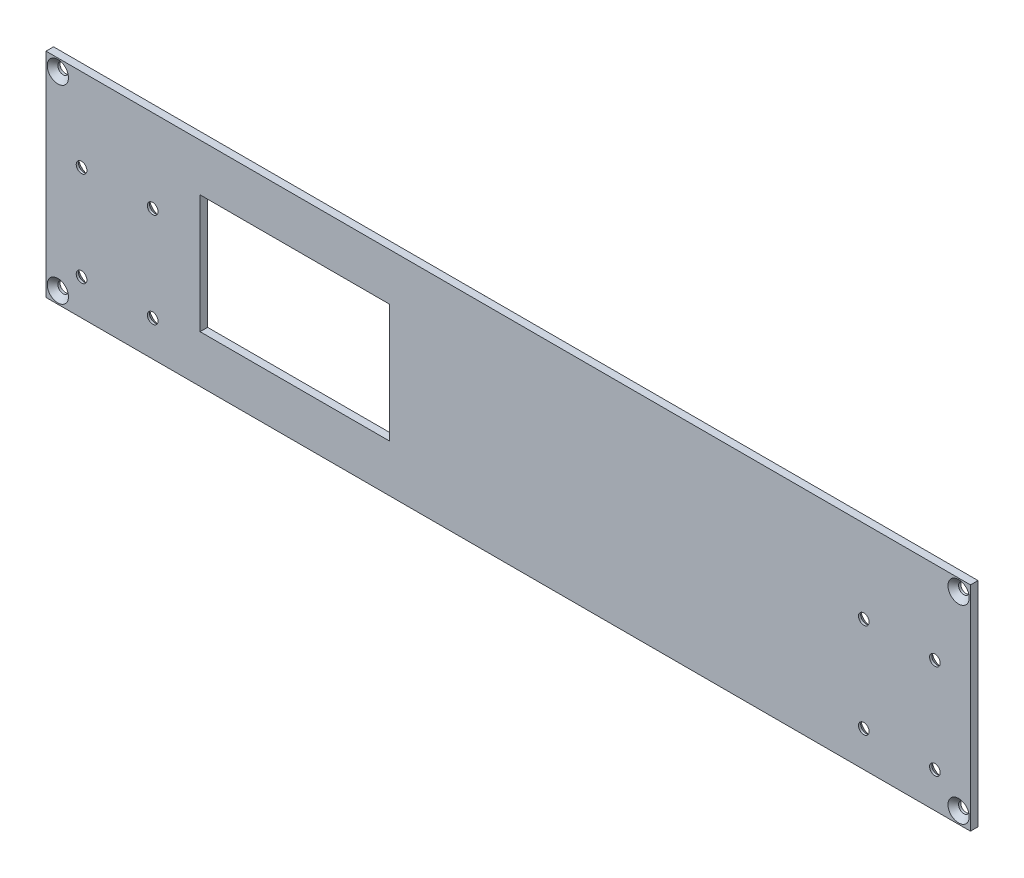
from build123d import *

# Parameters (mm, degrees)
SKETCH1_W                    = 390
SKETCH1_H                    = 90
BOSS_EXTRUDE1_DEPTH          = 3.175
CSK_FOR_M4_SFHCS1_AT_2_COUNT = 2
CSK_FOR_M4_SFHCS1_AT_2_PITCH = 50
CSK_FOR_M4_SFHCS1_AT_3_COUNT = 2
CSK_FOR_M4_SFHCS1_AT_3_PITCH = 30
CSK_FOR_M4_SFHCS1_AT_4_COUNT = 2
CSK_FOR_M4_SFHCS1_AT_4_PITCH = 40
CSK_FOR_M4_SFHCS3_AT_2_COUNT = 2
CSK_FOR_M4_SFHCS3_AT_2_PITCH = 80
SKETCH8_W                    = 80
SKETCH8_H                    = 50
CUT_EXTRUDE1_DEPTH           = 3.175


with BuildPart() as part:
    # Sketch1 → Boss-Extrude1 (new body)
    with BuildSketch(Plane.XY):
        Rectangle(SKETCH1_W, SKETCH1_H)
    extrude(amount=BOSS_EXTRUDE1_DEPTH)

    # Sketch5 → CSK for M4 SFHCS1 (revolve, cut)
    with BuildSketch(Plane(origin=(150, 10, 0), x_dir=(0, 1, 0), z_dir=(1, 0, 0))):
        Polygon((0, 0), (0, 3.175), (2.25, 3.175), (2.25, 2.23), (4.48, 0), align=None)
    csk_for_m4_sfhcs1 = revolve(axis=Axis((150, 10, -6.35), (0, 0, 1)), mode=Mode.SUBTRACT)

    # CSK for M4 SFHCS1 at 2: CSK for M4 SFHCS1 ×2
    with Locations(*[Vector(0.6, -0.8, 0) * (i * CSK_FOR_M4_SFHCS1_AT_2_PITCH) for i in range(1, CSK_FOR_M4_SFHCS1_AT_2_COUNT)]):
        add(csk_for_m4_sfhcs1, mode=Mode.SUBTRACT)

    # CSK for M4 SFHCS1 at 3: CSK for M4 SFHCS1 ×2
    with Locations(*[(i * CSK_FOR_M4_SFHCS1_AT_3_PITCH, 0, 0) for i in range(1, CSK_FOR_M4_SFHCS1_AT_3_COUNT)]):
        add(csk_for_m4_sfhcs1, mode=Mode.SUBTRACT)

    # CSK for M4 SFHCS1 at 4: CSK for M4 SFHCS1 ×2
    with Locations(*[(0, -i * CSK_FOR_M4_SFHCS1_AT_4_PITCH, 0) for i in range(1, CSK_FOR_M4_SFHCS1_AT_4_COUNT)]):
        add(csk_for_m4_sfhcs1, mode=Mode.SUBTRACT)

    # Sketch7 → CSK for M4 SFHCS3 (revolve, cut)
    with BuildSketch(Plane(origin=(190, 40, 3.175), x_dir=(0, -1, 0), z_dir=(1, 0, 0))):
        Polygon((0, 0), (0, 3.175), (2.25, 3.175), (2.25, 2.23), (4.48, 0), align=None)
    csk_for_m4_sfhcs3 = revolve(axis=Axis((190, 40, 9.525), (0, 0, -1)), mode=Mode.SUBTRACT)

    # CSK for M4 SFHCS3 at 2: CSK for M4 SFHCS3 ×2
    with Locations(*[(0, -i * CSK_FOR_M4_SFHCS3_AT_2_PITCH, 0) for i in range(1, CSK_FOR_M4_SFHCS3_AT_2_COUNT)]):
        add(csk_for_m4_sfhcs3, mode=Mode.SUBTRACT)

    # Mirror1: CSK for M4 SFHCS1, CSK for M4 SFHCS3 across plane
    add(csk_for_m4_sfhcs1.mirror(Plane(origin=(0, 0, 0), x_dir=(0, 0, 1), z_dir=(1, 0, 0))), mode=Mode.SUBTRACT)
    add(csk_for_m4_sfhcs3.mirror(Plane(origin=(0, 0, 0), x_dir=(0, 0, 1), z_dir=(1, 0, 0))), mode=Mode.SUBTRACT)

    # Mirror1 copy 1 sketch → Mirror1 copy 1 (revolve, cut)
    with BuildSketch(Plane(origin=(-180, -30, 0), x_dir=(0, 1, 0), z_dir=(-1, 0, 0))):
        Polygon((0, 0), (0, -3.175), (2.25, -3.175), (2.25, -2.23), (4.48, 0), align=None)
    revolve(axis=Axis((-180, -30, -6.35), (0, 0, -1)), mode=Mode.SUBTRACT)

    # Mirror1 copy 2 sketch → Mirror1 copy 2 (revolve, cut)
    with BuildSketch(Plane(origin=(-180, 10, 0), x_dir=(0, 1, 0), z_dir=(-1, 0, 0))):
        Polygon((0, 0), (0, -3.175), (2.25, -3.175), (2.25, -2.23), (4.48, 0), align=None)
    revolve(axis=Axis((-180, 10, -6.35), (0, 0, -1)), mode=Mode.SUBTRACT)

    # Mirror1 copy 3 sketch → Mirror1 copy 3 (revolve, cut)
    with BuildSketch(Plane(origin=(-150, -30, 0), x_dir=(0, 1, 0), z_dir=(-1, 0, 0))):
        Polygon((0, 0), (0, -3.175), (2.25, -3.175), (2.25, -2.23), (4.48, 0), align=None)
    revolve(axis=Axis((-150, -30, -6.35), (0, 0, -1)), mode=Mode.SUBTRACT)

    # Mirror1 copy 4 sketch → Mirror1 copy 4 (revolve, cut)
    with BuildSketch(Plane(origin=(-190, -40, 3.175), x_dir=(0, -1, 0), z_dir=(-1, 0, 0))):
        Polygon((0, 0), (0, -3.175), (2.25, -3.175), (2.25, -2.23), (4.48, 0), align=None)
    revolve(axis=Axis((-190, -40, 9.525), (0, 0, 1)), mode=Mode.SUBTRACT)

    # Sketch8 → Cut-Extrude1 (cut)
    with BuildSketch(Plane.XY.offset(3.175)):
        with Locations((-90, 0)):
            Rectangle(SKETCH8_W, SKETCH8_H)
    extrude(amount=-CUT_EXTRUDE1_DEPTH, mode=Mode.SUBTRACT)


solid = part.part
